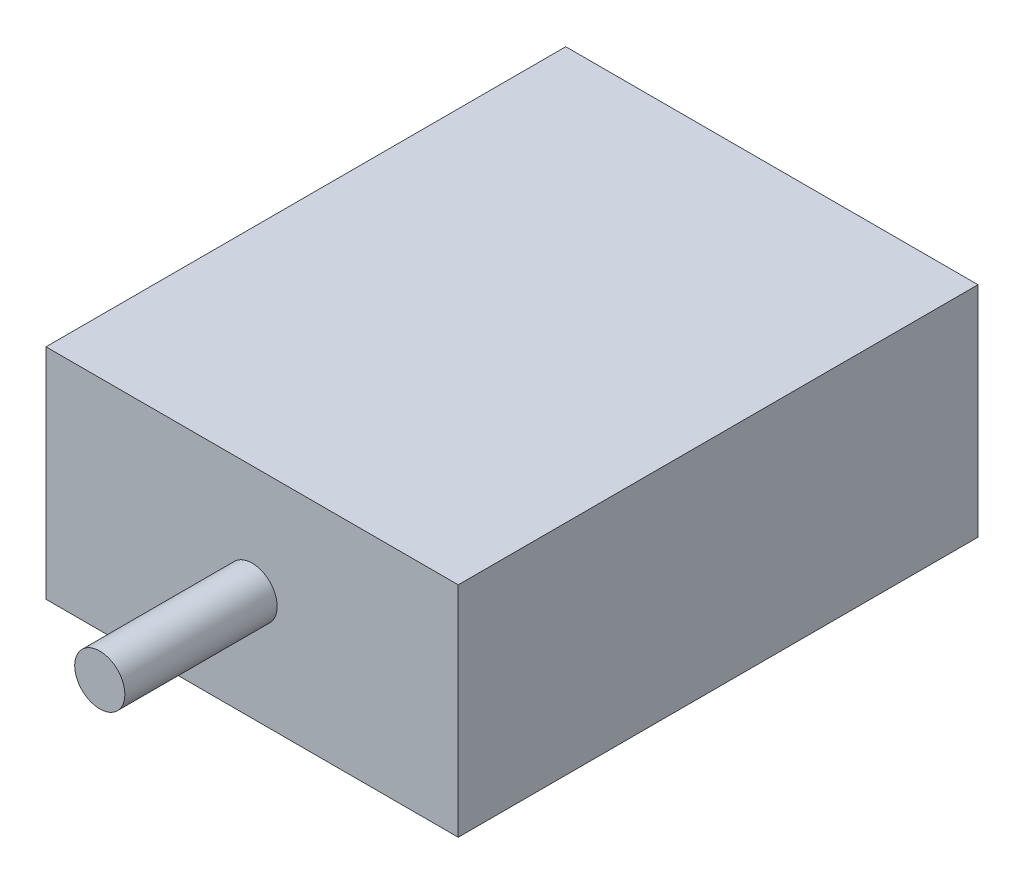
from build123d import *

# Parameters (mm, degrees)
SKETCH2_W                                      = 23
SKETCH2_H                                      = 12.2
SG90_REFERENCE_ENVELOPE_DEPTH                  = 29
OUTPUT_AXIS_REFERENCE_NOT_VENDOR_GEOMETR_START = 29
SKETCH3_R                                      = 1.4
OUTPUT_AXIS_REFERENCE_NOT_VENDOR_GEOMETR_DEPTH = 8.5


with BuildPart() as part:
    # Sketch2 → SG90_reference_envelope (new body)
    with BuildSketch(Plane.XY):
        Rectangle(SKETCH2_W, SKETCH2_H)
    extrude(amount=SG90_REFERENCE_ENVELOPE_DEPTH)

    # Sketch3 → Output_axis_REFERENCE_NOT_VENDOR_GEOMETRY (add)
    with BuildSketch(Plane.XY.offset(OUTPUT_AXIS_REFERENCE_NOT_VENDOR_GEOMETR_START)):
        with Locations(Location((0, 0, 0), (0, 0, 180))):
            Circle(SKETCH3_R)
    extrude(amount=OUTPUT_AXIS_REFERENCE_NOT_VENDOR_GEOMETR_DEPTH)


solid = part.part
